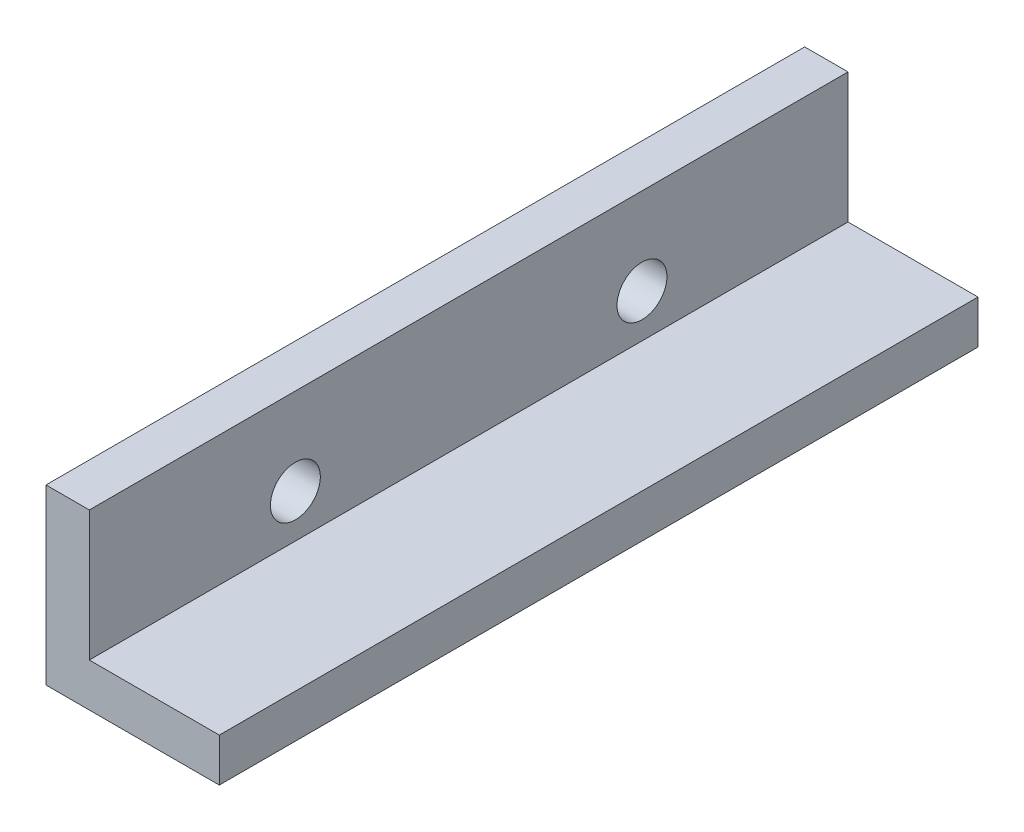
from build123d import *

# Parameters (mm, degrees)
BOSS_EXTRUDE1_DEPTH = 27.800000026
SKETCH2_R           = 1.8288
CUT_EXTRUDE1_DEPTH  = 34.097129807


with BuildPart() as part:
    # Sketch1 → Boss-Extrude1 (new, symmetric)
    with BuildSketch(Plane.XY):
        Polygon((0, 12.7), (0, 0), (12.7, 0), (12.7, 3.175), (3.175, 3.175), (3.175, 12.7), align=None)
    extrude(amount=BOSS_EXTRUDE1_DEPTH, both=True)

    # Sketch2 → Cut-Extrude1 (cut, through all)
    with BuildSketch(Plane.ZY):
        with Locations((12.7, 6.35)):
            Circle(SKETCH2_R)
        with Locations((-12.7, 6.35)):
            Circle(SKETCH2_R)
    extrude(amount=-CUT_EXTRUDE1_DEPTH, mode=Mode.SUBTRACT)


solid = part.part
